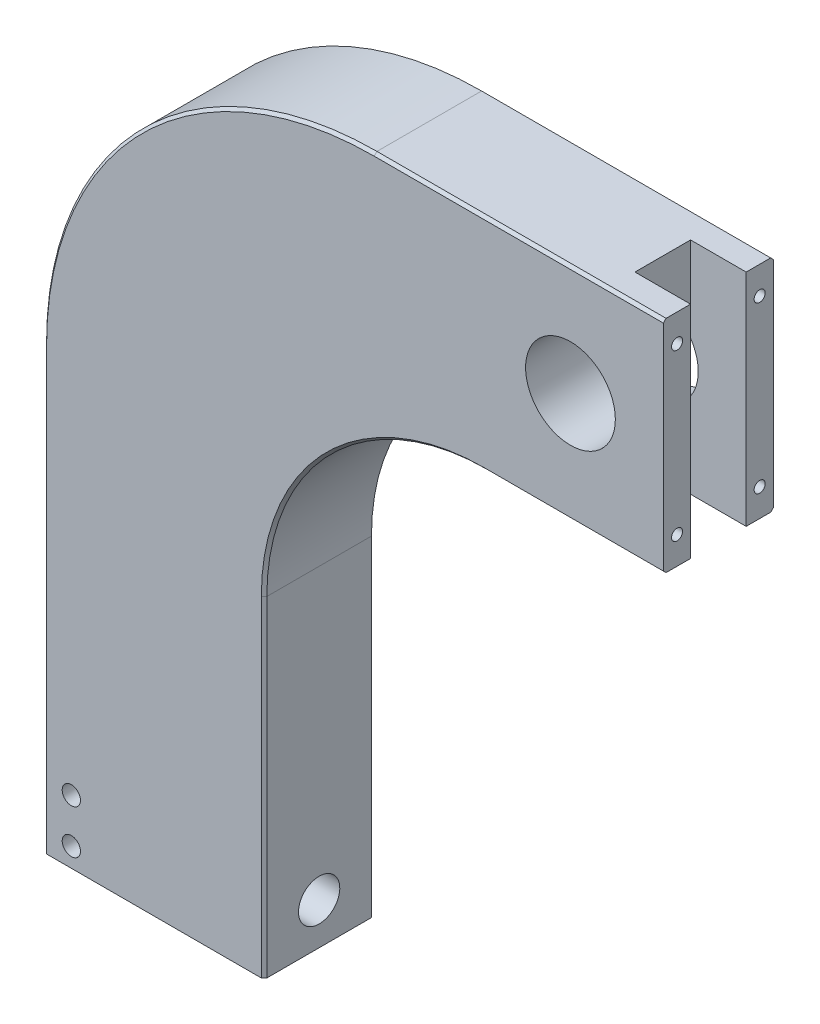
from build123d import *

# Parameters (mm, degrees)
SKETCH1_R                   = 20.701
BOSS_EXTRUDE1_DEPTH         = 25.4
SKETCH2_W                   = 25.654
SKETCH2_H                   = 101.6
CUT_EXTRUDE1_DEPTH          = 25.654
F_1_4_20_TAPPED_HOLE1_D     = 5.1054
F_1_4_20_TAPPED_HOLE1_DEPTH = 25.4
F_1_4_20_TAPPED_HOLE1_TIP   = 1.533816902
F_3_8_24_TAPPED_HOLE1_D     = 8.4328
SKETCH10_R                  = 9.525
CUT_EXTRUDE2_DEPTH          = 19.05
CHAMFER1_SIZE               = 1.27


with BuildPart() as part:
    # Sketch1 → Boss-Extrude1 (new, symmetric)
    with BuildSketch(Plane.XY):
        with BuildLine():
            Line((0, 0), (0, 203.2))
            ThreePointArc((0, 203.2), (44.636926547, 310.963073453), (152.4, 355.6))
            Line((152.4, 355.6), (285.75, 355.6))
            Line((285.75, 355.6), (285.75, 254))
            Line((285.75, 254), (203.2, 254))
            ThreePointArc((203.2, 254), (131.357951031, 224.242048969), (101.6, 152.4))
            Line((101.6, 152.4), (101.6, 0))
            Line((101.6, 0), (0, 0))
        make_face()
        with Locations((242.9256, 304.8)):
            Circle(SKETCH1_R, mode=Mode.SUBTRACT)
    extrude(amount=BOSS_EXTRUDE1_DEPTH, both=True)

    # Sketch2 → Cut-Extrude1 (cut)
    with BuildSketch(Plane(origin=(285.75, 0, 0), x_dir=(0, 0, -1), z_dir=(1, 0, 0))):
        with Locations((0, 304.8)):
            Rectangle(SKETCH2_W, SKETCH2_H)
    extrude(amount=-CUT_EXTRUDE1_DEPTH, mode=Mode.SUBTRACT)

    # 1/4-20 Tapped Hole1
    with Locations(Plane(origin=(285.75, 0, 0), x_dir=(0, 0, -1), z_dir=(1, 0, 0))):
        with Locations((19.05, 342.9), (-19.05, 342.9), (-19.05, 266.7), (19.05, 266.7)):
            Hole(F_1_4_20_TAPPED_HOLE1_D / 2, depth=F_1_4_20_TAPPED_HOLE1_DEPTH)
            with Locations((0, 0, -(F_1_4_20_TAPPED_HOLE1_DEPTH + F_1_4_20_TAPPED_HOLE1_TIP / 2))):  # 118° drill point
                Cone(0, F_1_4_20_TAPPED_HOLE1_D / 2, F_1_4_20_TAPPED_HOLE1_TIP, mode=Mode.SUBTRACT)

    # 3/8-24 Tapped Hole1 (through all)
    with Locations(Plane.XY.offset(25.4)):
        with Locations((12.7, 29.21), (12.7, 8.89)):
            Hole(F_3_8_24_TAPPED_HOLE1_D / 2)

    # Sketch10 → Cut-Extrude2 (cut)
    with BuildSketch(Plane(origin=(101.6, 0, 0), x_dir=(0, 0, -1), z_dir=(1, 0, 0))):
        with Locations(Location((0, 19.05, 0), (0, 0, 90))):
            Circle(SKETCH10_R)
    extrude(amount=-CUT_EXTRUDE2_DEPTH, mode=Mode.SUBTRACT)

    # Chamfer1
    chamfer1_edges = [part.edges().sort_by_distance(p)[0] for p in [
        (244.475, 254, -25.4),
        (131.357951031, 224.242048969, -25.4),
        (101.6, 76.2, -25.4),
        (131.357951031, 224.242048969, 25.4),
        (244.475, 254, 25.4),
        (219.075, 355.6, 25.4),
        (44.636926547, 310.963073453, 25.4),
        (0, 101.6, 25.4),
        (0, 101.6, -25.4),
        (101.6, 76.2, 25.4),
        (44.636926547, 310.963073453, -25.4),
        (219.075, 355.6, -25.4),
    ]]
    chamfer(chamfer1_edges, length=CHAMFER1_SIZE)


solid = part.part
